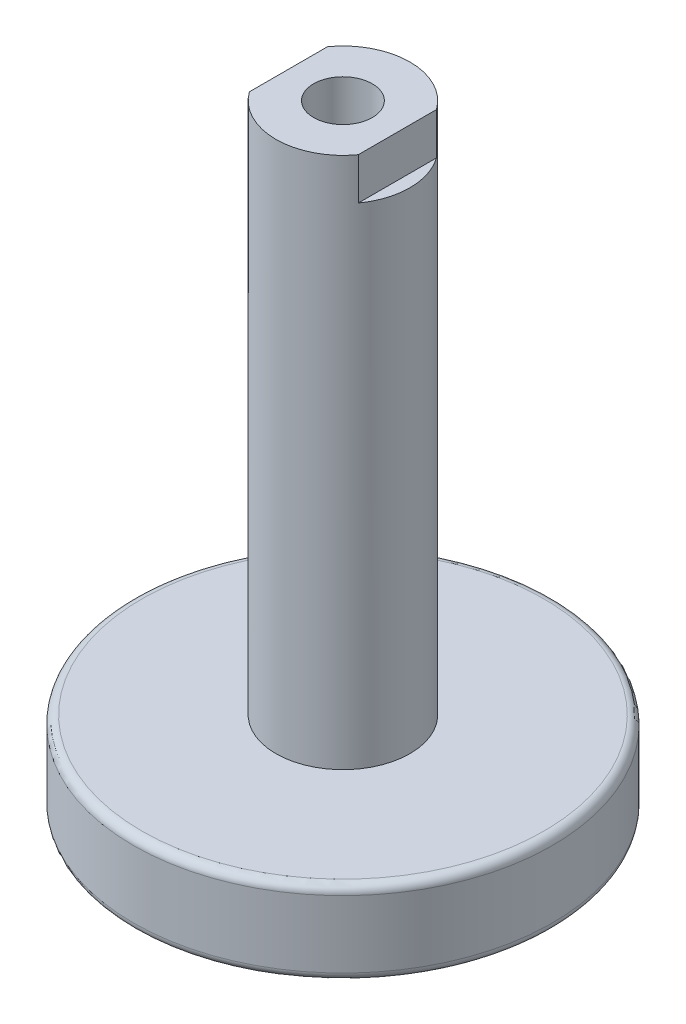
from build123d import *

# Parameters (mm, degrees)
SKETCH1_R                 = 25
BOSS_EXTRUDE1_DEPTH       = 10
FILLET1_R                 = 1
SKETCH2_R                 = 8
BOSS_EXTRUDE2_DEPTH       = 63.5
M8X1_0_TAPPED_HOLE1_D     = 7
M8X1_0_TAPPED_HOLE1_DEPTH = 12
M8X1_0_TAPPED_HOLE1_TIP   = 2.103012167
SKETCH5_OUTSIDE_W         = 72.398
SKETCH5_OUTSIDE_H         = 72.398
SKETCH5_OUTSIDE_W_2       = 13
SKETCH5_OUTSIDE_H_2       = 18.1448046
CUT_EXTRUDE1_DEPTH        = 5


with BuildPart() as part:
    # Sketch1 → Boss-Extrude1 (new body)
    with BuildSketch(Plane(origin=(0, 0, 0), x_dir=(1, 0, 0), z_dir=(0, 1, 0))):
        with Locations(Location((0, 0, 0), (0, 0, 270))):
            Circle(SKETCH1_R)
    extrude(amount=BOSS_EXTRUDE1_DEPTH)

    # Fillet1
    fillet1_edges = [part.edges().sort_by_distance(p)[0] for p in [
        (0, 0, -25),
        (0, 10, -25),
    ]]
    fillet(fillet1_edges, radius=FILLET1_R)

    # Sketch2 → Boss-Extrude2 (add)
    with BuildSketch(Plane(origin=(0, 10, 0), x_dir=(1, 0, 0), z_dir=(0, 1, 0))):
        with Locations(Location((0, 0, 0), (0, 0, 270))):
            Circle(SKETCH2_R)
    extrude(amount=BOSS_EXTRUDE2_DEPTH)

    # M8x1.0 Tapped Hole1
    with Locations(Plane(origin=(0, 73.5, 0), x_dir=(1, 0, 0), z_dir=(0, 1, 0))):
        with Locations((0, 0)):
            Hole(M8X1_0_TAPPED_HOLE1_D / 2, depth=M8X1_0_TAPPED_HOLE1_DEPTH)
            with Locations((0, 0, -(M8X1_0_TAPPED_HOLE1_DEPTH + M8X1_0_TAPPED_HOLE1_TIP / 2))):  # 118° drill point
                Cone(0, M8X1_0_TAPPED_HOLE1_D / 2, M8X1_0_TAPPED_HOLE1_TIP, mode=Mode.SUBTRACT)

    # Sketch5 outside → Cut-Extrude1 (cut)
    with BuildSketch(Plane(origin=(0, 73.5, 0), x_dir=(1, 0, 0), z_dir=(0, 1, 0))):
        Rectangle(SKETCH5_OUTSIDE_W, SKETCH5_OUTSIDE_H)
        Rectangle(SKETCH5_OUTSIDE_W_2, SKETCH5_OUTSIDE_H_2, mode=Mode.SUBTRACT)
    extrude(amount=-CUT_EXTRUDE1_DEPTH, mode=Mode.SUBTRACT)


solid = part.part
